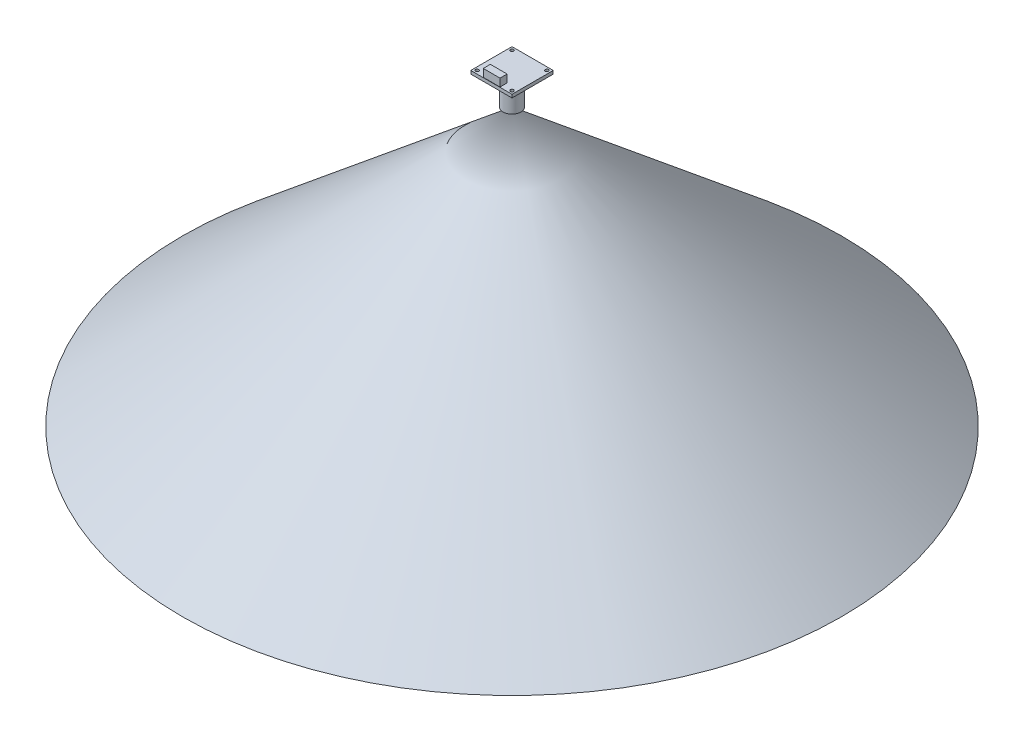
from build123d import *

# Parameters (mm, degrees)
SKETCH_1_W      = 32
SKETCH_1_H      = 32
SKETCH_1_R      = 1.25
EXTRUDE_1_DEPTH = 2.5
SKETCH_2_W      = 13
SKETCH_2_H      = 5.5
EXTRUDE_2_DEPTH = 6
SKETCH_3_R      = 6.9
EXTRUDE_3_DEPTH = 22


with BuildPart() as part:
    # 草图1 → 凸台-拉伸1 (new body)
    with BuildSketch(Plane(origin=(0, 0, 0), x_dir=(1, 0, 0), z_dir=(0, 1, 0))):
        Rectangle(SKETCH_1_W, SKETCH_1_H)
        with Locations(Location((-13.5, 13.5, 0), (0, 0, 270))):
            Circle(SKETCH_1_R, mode=Mode.SUBTRACT)
        with Locations(Location((13.5, 13.5, 0), (0, 0, 90))):
            Circle(SKETCH_1_R, mode=Mode.SUBTRACT)
        with Locations(Location((13.5, -13.5, 0), (0, 0, 270))):
            Circle(SKETCH_1_R, mode=Mode.SUBTRACT)
        with Locations(Location((-13.5, -13.5, 0), (0, 0, 90))):
            Circle(SKETCH_1_R, mode=Mode.SUBTRACT)
    extrude(amount=EXTRUDE_1_DEPTH)


with BuildPart() as body_2:
    # 草图2 → 凸台-拉伸2 (new body)
    with BuildSketch(Plane(origin=(0, 2.5, 0), x_dir=(1, 0, 0), z_dir=(0, 1, 0))):
        with Locations((0, -13.05)):
            Rectangle(SKETCH_2_W, SKETCH_2_H)
    extrude(amount=EXTRUDE_2_DEPTH)


with BuildPart() as body_3:
    # 草图3 → 凸台-拉伸3 (new body)
    with BuildSketch(Plane.XZ):
        with Locations(Location((0, 0, 0), (0, 0, 270))):
            Circle(SKETCH_3_R)
    extrude(amount=EXTRUDE_3_DEPTH)


with BuildPart() as body_4:
    # 草图5 → 旋转1 (revolve)
    with BuildSketch(Plane.XY, mode=Mode.PRIVATE) as revolve_1_sk:
        Polygon((0, -22), (255.800314088, -236.641949206), (0, -236.641949206), align=None)
    revolve(revolve_1_sk.sketch.rotate(Axis((0, 10.025, 0), (0, -1, 0)), 270), axis=Axis((0, 10.025, 0), (0, -1, 0)))


solid = Compound([part.part, body_2.part, body_3.part, body_4.part])
